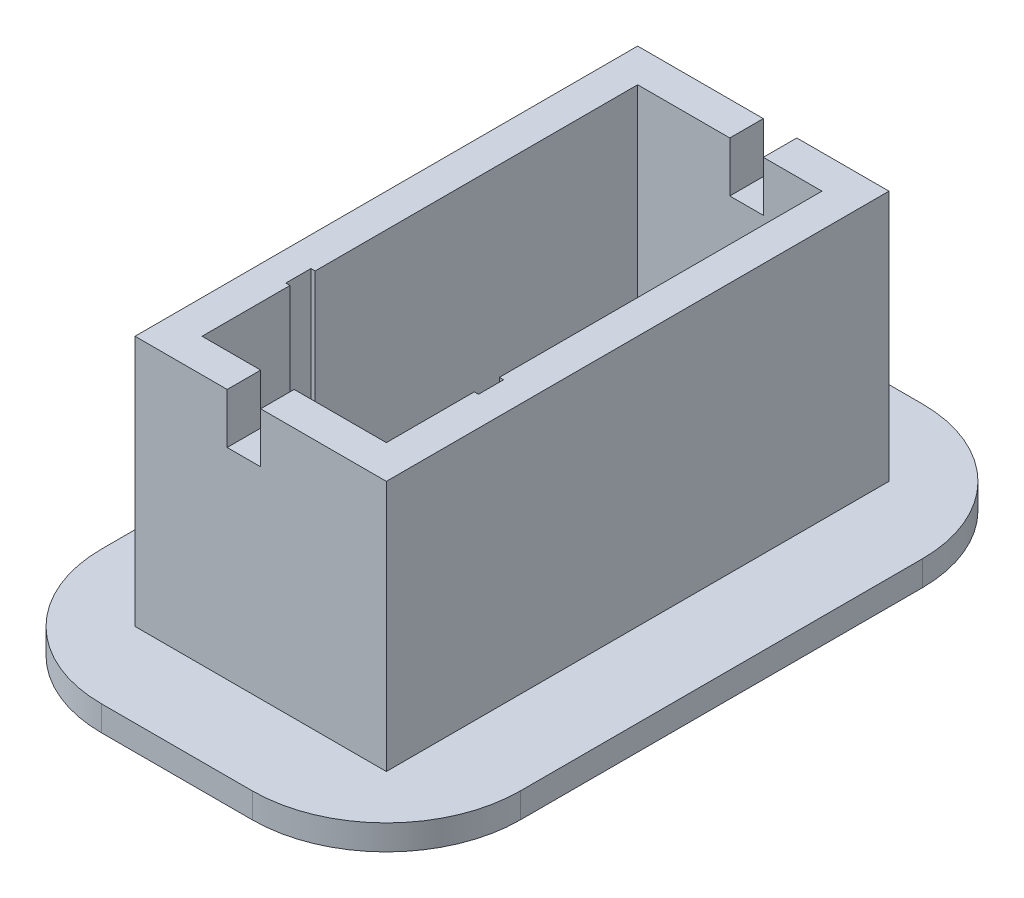
from build123d import *

# Parameters (mm, degrees)
SKETCH1_W           = 15
SKETCH1_H           = 30
BOSS_EXTRUDE1_DEPTH = 15
SKETCH2_W           = 25
SKETCH2_H           = 40
BOSS_EXTRUDE2_DEPTH = 1.5
SKETCH4_W           = 2
SKETCH4_H           = 2
CUT_EXTRUDE2_DEPTH  = 3
FILLET2_R           = 8


with BuildPart() as part:
    # Sketch1 → Boss-Extrude1 (new body)
    with BuildSketch(Plane(origin=(0, 0, 0), x_dir=(1, 0, 0), z_dir=(0, 1, 0))):
        with Locations((7.5, 15)):
            Rectangle(SKETCH1_W, SKETCH1_H)
        Polygon((2, 2), (13, 2), (13, 7.25), (13.25, 7.25), (13.25, 8.75), (13, 8.75), (13, 28), (2, 28), (2, 8.75), (1.75, 8.75), (1.75, 7.25), (2, 7.25), align=None, mode=Mode.SUBTRACT)
    extrude(amount=BOSS_EXTRUDE1_DEPTH)

    # Sketch2 → Boss-Extrude2 (add)
    with BuildSketch(Plane.XZ):
        with Locations((7.5, -15)):
            Rectangle(SKETCH2_W, SKETCH2_H)
    extrude(amount=BOSS_EXTRUDE2_DEPTH)

    # Sketch4 → Cut-Extrude2 (cut)
    with BuildSketch(Plane(origin=(0, 15, 0), x_dir=(1, 0, 0), z_dir=(0, 1, 0))):
        with Locations((8.5, 29)):
            Rectangle(SKETCH4_W, SKETCH4_H)
        with Locations((6.5, 1)):
            Rectangle(SKETCH4_W, SKETCH4_H)
    extrude(amount=-CUT_EXTRUDE2_DEPTH, mode=Mode.SUBTRACT)

    # Fillet2
    fillet2_edges = [part.edges().sort_by_distance(p)[0] for p in [
        (-5, -0.75, 5),
        (-5, -0.75, -35),
        (20, -0.75, -35),
        (20, -0.75, 5),
    ]]
    fillet(fillet2_edges, radius=FILLET2_R)


solid = part.part
